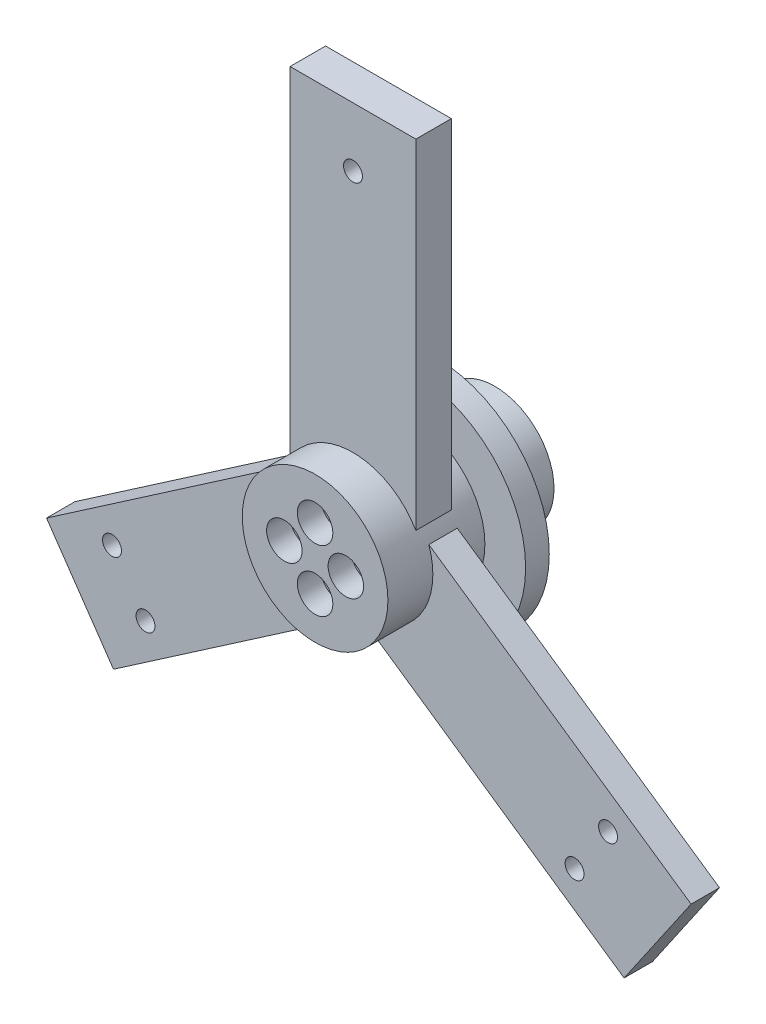
from build123d import *

# Parameters (mm, degrees)
SKETCH1_R                = 25
BOSS_EXTRUDE1_DEPTH      = 25
SKETCH2_R                = 48
BOSS_EXTRUDE2_DEPTH      = 10
SKETCH3_R                = 30.78576119
BOSS_EXTRUDE3_DEPTH      = 41
BOSS_EXTRUDE4_DEPTH      = 113
BOSS_EXTRUDE4_DEPTH_BACK = 31
SKETCH5_W                = 12
SKETCH5_H                = 50
BOSS_EXTRUDE5_DEPTH      = 122
BOSS_EXTRUDE5_DEPTH_BACK = 21
SKETCH6_W                = 12
SKETCH6_H                = 50
SKETCH7_R                = 3
CUT_EXTRUDE1_DEPTH       = 25
BOSS_EXTRUDE6_DEPTH      = 128
BOSS_EXTRUDE6_DEPTH_BACK = 16
SKETCH9_W                = 53.159298554
SKETCH9_H                = 15
SKETCH8_R                = 7.5
CUT_EXTRUDE2_DEPTH       = 10
SKETCH10_R               = 4
CUT_EXTRUDE3_DEPTH       = 72
SKETCH11_R               = 4
CUT_EXTRUDE4_DEPTH       = 72


with BuildPart() as part:
    # Sketch1 → Boss-Extrude1 (new body)
    with BuildSketch(Plane.XY):
        Circle(SKETCH1_R)
    extrude(amount=BOSS_EXTRUDE1_DEPTH)

    # Sketch2 → Boss-Extrude2 (add)
    with BuildSketch(Plane.XY.offset(25)):
        Circle(SKETCH2_R)
    extrude(amount=BOSS_EXTRUDE2_DEPTH)

    # Sketch3 → Boss-Extrude3 (add)
    with BuildSketch(Plane.XY.offset(35)):
        Circle(SKETCH3_R)
    extrude(amount=BOSS_EXTRUDE3_DEPTH)

    # Sketch5 → Boss-Extrude4 (add, two sides: drawn at the far end of the back side and taken through both)
    with BuildSketch(Plane(origin=(-25.371352033, -17.437247146, 0), x_dir=(0, 0, 1), z_dir=(-0.8241261886220168, -0.5664062369248312, 0)).offset(-BOSS_EXTRUDE4_DEPTH_BACK)):
        with Locations((51, -0.21423881)):
            Rectangle(SKETCH5_W, SKETCH5_H)
    extrude(amount=BOSS_EXTRUDE4_DEPTH + BOSS_EXTRUDE4_DEPTH_BACK)

    # Sketch6 → Boss-Extrude5 (add, two sides: drawn at the far end of the back side and taken through both)
    with BuildSketch(Plane(origin=(25.371352033, -17.437247146, 0), x_dir=(0, 0, -1), z_dir=(0.8241261886220168, -0.5664062369248313, 0)).offset(-BOSS_EXTRUDE5_DEPTH_BACK)):
        with Locations((-51, -0.21423881)):
            Rectangle(SKETCH6_W, SKETCH6_H)
    extrude(amount=BOSS_EXTRUDE5_DEPTH + BOSS_EXTRUDE5_DEPTH_BACK)

    # Sketch7 → Cut-Extrude1 (cut)
    with BuildSketch(Plane(origin=(0, 0, 0), x_dir=(-1, 0, 0), z_dir=(0, 0, -1))):
        Circle(SKETCH7_R)
    extrude(amount=-CUT_EXTRUDE1_DEPTH, mode=Mode.SUBTRACT)

    # Sketch9 → Boss-Extrude6 (add, two sides: drawn at the far end of the back side and taken through both)
    with BuildSketch(Plane(origin=(0, 30.78576119, 0), x_dir=(1, 0, 0), z_dir=(0, 1, 0)).offset(-BOSS_EXTRUDE6_DEPTH_BACK)):
        with Locations((0.01957738, -52.5)):
            Rectangle(SKETCH9_W, SKETCH9_H)
    extrude(amount=BOSS_EXTRUDE6_DEPTH + BOSS_EXTRUDE6_DEPTH_BACK)

    # Sketch8 → Cut-Extrude2 (cut)
    with BuildSketch(Plane.XY.offset(76)):
        with Locations((-13, 0)):
            Circle(SKETCH8_R)
        with Locations((13, 0)):
            Circle(SKETCH8_R)
        with Locations((0, 13)):
            Circle(SKETCH8_R)
        with Locations((0, -13)):
            Circle(SKETCH8_R)
    extrude(amount=-CUT_EXTRUDE2_DEPTH, mode=Mode.SUBTRACT)

    # Sketch10 → Cut-Extrude3 (cut)
    with BuildSketch(Plane.XY.offset(57)):
        with Locations((-104.853188395, -57.155978452)):
            Circle(SKETCH10_R)
        with Locations((-90.693032472, -77.759133168)):
            Circle(SKETCH10_R)
    cut_extrude3 = extrude(amount=-CUT_EXTRUDE3_DEPTH, mode=Mode.SUBTRACT)

    # Mirror1: Cut-Extrude3 across plane
    add(cut_extrude3.mirror(Plane.ZY), mode=Mode.SUBTRACT)

    # Sketch11 → Cut-Extrude4 (cut)
    with BuildSketch(Plane.XY.offset(60)):
        with Locations((0.01957738, 133.78576119)):
            Circle(SKETCH11_R)
    extrude(amount=-CUT_EXTRUDE4_DEPTH, mode=Mode.SUBTRACT)


solid = part.part
